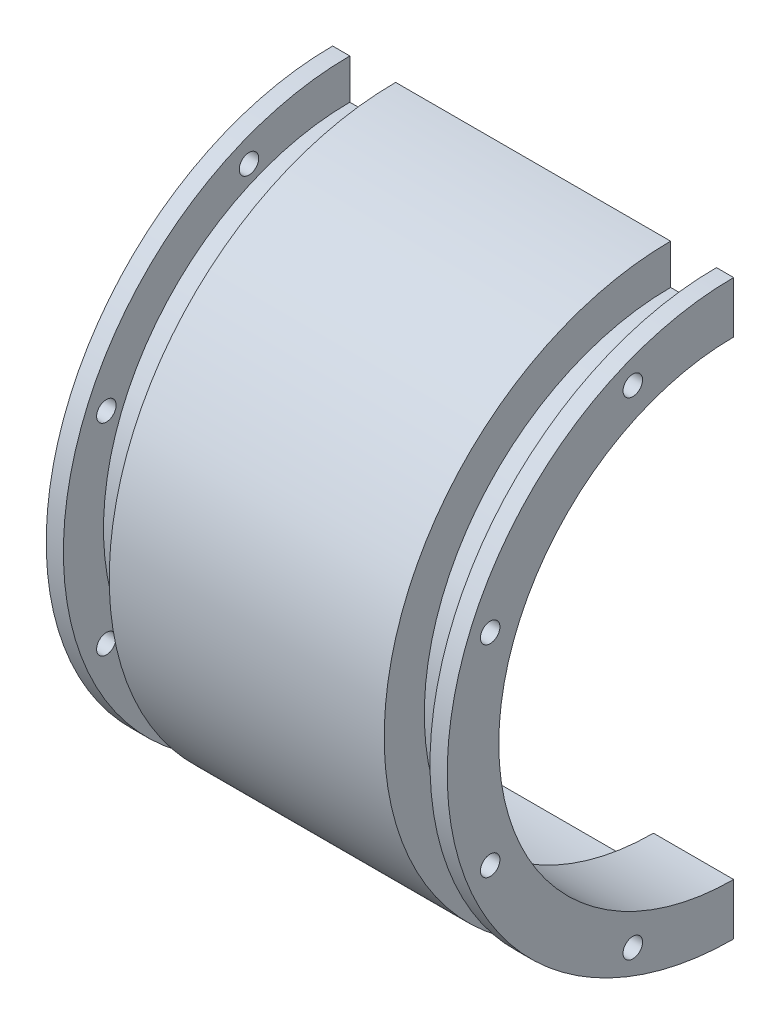
from build123d import *

# Parameters (mm, degrees)
REVOLVE_1_ANGLE          = 180
HOLE_WIZARD_M3_1_D       = 3.4
HOLE_WIZARD_M3_1_DEPTH   = 3
PATTERN_CIRCULAR_1_COUNT = 4
PATTERN_CIRCULAR_1_ANGLE = 135
MIRROR_1_COPY_1_D        = 3.4
MIRROR_1_COPY_1_DEPTH    = 3
MIRROR_1_COPY_2_D        = 3.4
MIRROR_1_COPY_2_DEPTH    = 3
MIRROR_1_COPY_3_D        = 3.4
MIRROR_1_COPY_3_DEPTH    = 3
FILLET_1_R               = 5


with BuildPart() as part:
    # ｽｹｯﾁ1 → 回転1 (revolve)
    with BuildSketch(Plane.XY):
        Polygon((-35, 41), (-21, 41), (-21, 47), (21, 47), (21, 41), (35, 41), (35, 50), (32, 50), (32, 43), (24, 43), (24, 50), (-24, 50), (-24, 43), (-32, 43), (-32, 50), (-35, 50), align=None)
    revolve(axis=Axis((-50, 0, 0), (1, 0, 0)), revolution_arc=REVOLVE_1_ANGLE)

    # M3 すきま穴1
    with Locations(Plane.ZY.offset(35)):
        with Locations((17.603437889, -42.498458496)):
            hole_wizard_m3_1 = Hole(HOLE_WIZARD_M3_1_D / 2, depth=HOLE_WIZARD_M3_1_DEPTH)

    # 円形ﾊﾟﾀｰﾝ1: M3 すきま穴1 ×4 about axis
    pattern_circular_1_axis = Axis((0, 0, 0), (-1, 0, 0))
    for i in range(1, PATTERN_CIRCULAR_1_COUNT):
        add(hole_wizard_m3_1.rotate(pattern_circular_1_axis, i * PATTERN_CIRCULAR_1_ANGLE / (PATTERN_CIRCULAR_1_COUNT - 1)), mode=Mode.SUBTRACT)

    # ﾐﾗｰ1: M3 すきま穴1 across plane
    add(hole_wizard_m3_1.mirror(Plane(origin=(0, 0, 0), x_dir=(0, 0, 1), z_dir=(1, 0, 0))), mode=Mode.SUBTRACT)

    # ﾐﾗｰ1 copy 1
    with Locations(Plane(origin=(35, 0, 0), x_dir=(0, 0.7071067811865487, 0.7071067811865464), z_dir=(1, 0, 0))):
        with Locations((17.603437889, 42.498458496)):
            Hole(MIRROR_1_COPY_1_D / 2, depth=MIRROR_1_COPY_1_DEPTH)

    # ﾐﾗｰ1 copy 2
    with Locations(Plane.YZ.offset(35)):
        with Locations((17.603437889, 42.498458496)):
            Hole(MIRROR_1_COPY_2_D / 2, depth=MIRROR_1_COPY_2_DEPTH)

    # ﾐﾗｰ1 copy 3
    with Locations(Plane(origin=(35, 0, 0), x_dir=(0, 0.7071067811865441, -0.7071067811865509), z_dir=(1, 0, 0))):
        with Locations((17.603437889, 42.498458496)):
            Hole(MIRROR_1_COPY_3_D / 2, depth=MIRROR_1_COPY_3_DEPTH)

    # ﾌｨﾚｯﾄ1
    fillet_1_edges = [part.edges().sort_by_distance(p)[0] for p in [
        (21, 0, 47),
        (-21, 0, 47),
    ]]
    fillet(fillet_1_edges, radius=FILLET_1_R)


solid = part.part
